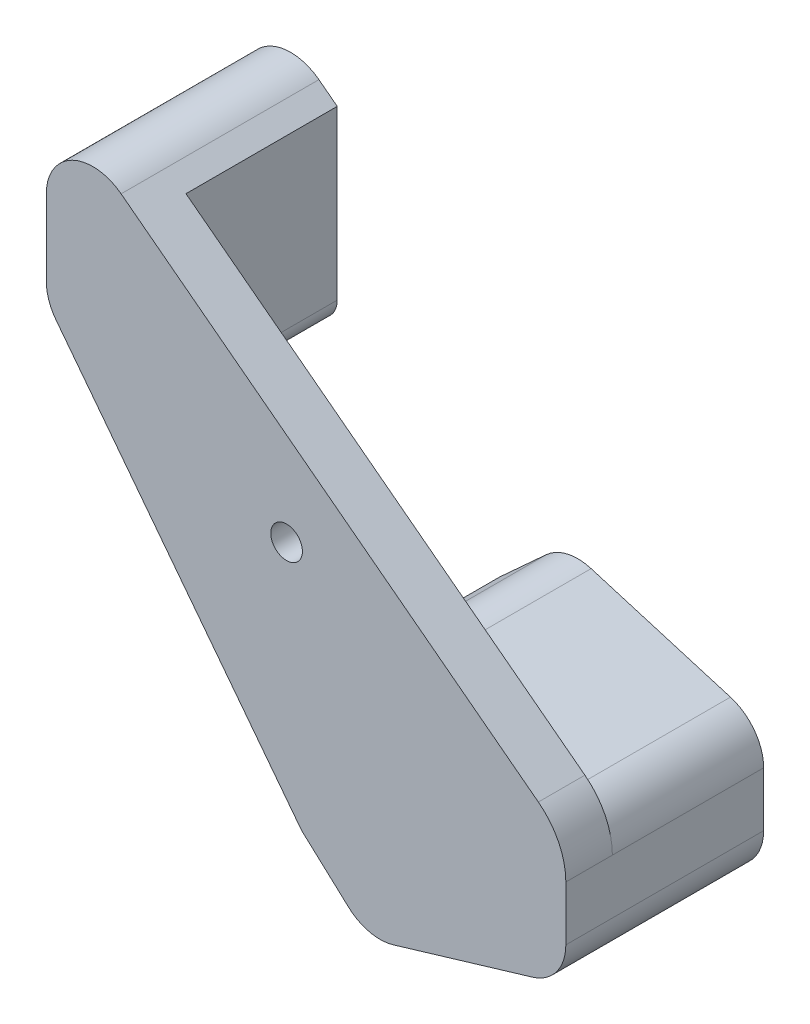
from build123d import *

# Parameters (mm, degrees)
SKETCH1_R           = 2.0319999999999987
SKETCH1_R_2         = 2.0320000000000005
BOSS_EXTRUDE1_DEPTH = 20.6375
FILLET1_R           = 6.35
BOSS_EXTRUDE2_START = 6.35
SKETCH3_R           = 2.159000000000005
BOSS_EXTRUDE2_DEPTH = 6.35
FILLET2_R           = 6.35
BOSS_EXTRUDE3_START = 20.6375
SKETCH4_R           = 2.032
BOSS_EXTRUDE3_DEPTH = 20.6375
FILLET3_R           = 3.175


with BuildPart() as part:
    # Sketch1 → Boss-Extrude1 (new body)
    with BuildSketch(Plane.XY):
        Polygon((0, 12.7), (0, 0), (11.112499999999999, -10.159999999999995), (38.1, -2.094157314500878), (38.1, 14.794157314500877), (11.112499999999999, 22.86), align=None)
        with Locations((11.112499999999999, 0)):
            Circle(SKETCH1_R, mode=Mode.SUBTRACT)
        with Locations((30.1625, 6.35)):
            Circle(SKETCH1_R_2, mode=Mode.SUBTRACT)
        with Locations((11.112499999999999, 12.7)):
            Circle(SKETCH1_R, mode=Mode.SUBTRACT)
    extrude(amount=BOSS_EXTRUDE1_DEPTH)

    # Fillet1
    fillet1_edges = [part.edges().sort_by_distance(p)[0] for p in [
        (0, 12.7, 10.31875),
        (11.112499999999999, 22.86, 10.31875),
        (38.1, 14.794157314500877, 10.31875),
        (38.1, -2.094157314500878, 10.31875),
        (11.112499999999999, -10.159999999999995, 10.31875),
        (0, 0, 10.31875),
    ]]
    fillet(fillet1_edges, radius=FILLET1_R)

    # Sketch3 → Boss-Extrude2 (add)
    with BuildSketch(Plane.XY.offset(20.6375).offset(BOSS_EXTRUDE2_START)):
        with BuildLine():
            Line((2.06521558288966, -1.888197104356259), (-32.77594211232474, 43.413196146372826))
            Line((-32.77594211232474, 43.413196146372826), (-32.77594211232474, 68.81319614637282))
            Line((-32.77594211232474, 68.81319614637282), (34.3497413303207, 17.639286263258136))
            ThreePointArc((34.3497413303207, 17.639286263258136), (37.1111008713377, 14.290641479729842), (38.1, 10.064460353186902))
            Line((38.1, 10.064460353186902), (38.1, 2.635539646813099))
            ThreePointArc((38.1, 2.635539646813099), (36.84259970760916, -1.157602614961311), (33.56836906517824, -3.448540722708889))
            Line((33.56836906517824, -3.448540722708889), (14.560051921917028, -9.129618843824993))
            ThreePointArc((14.560051921917028, -9.129618843824993), (11.324248271129079, -9.235318696210516), (8.456898439628453, -7.732021430517442))
            Line((8.456898439628453, -7.732021430517442), (2.06521558288966, -1.888197104356259))
        make_face()
        with Locations((1.57895919e-09, 31.151886065390322)):
            Circle(SKETCH3_R, mode=Mode.SUBTRACT)
    extrude(amount=-BOSS_EXTRUDE2_DEPTH)

    # Fillet2
    fillet2_edges = [part.edges().sort_by_distance(p)[0] for p in [
        (-32.77594211232474, 68.81319614637282, 23.812499999999996),
        (-32.77594211232474, 43.413196146372826, 23.812499999999996),
    ]]
    fillet(fillet2_edges, radius=FILLET2_R)

    # Sketch4 → Boss-Extrude3 (add)
    with BuildSketch(Plane(origin=(0, 0, 20.6375), x_dir=(-1, 0, 0), z_dir=(0, 0, -1)).offset(BOSS_EXTRUDE3_START)):
        with BuildLine():
            Line((32.77594211232474, 55.98737564555251), (32.77594211232474, 45.5726724047695))
            ThreePointArc((32.77594211232474, 45.5726724047695), (32.437811608681876, 43.52818587784627), (31.459430251294627, 41.701432660856774))
            Line((31.459430251294627, 41.701432660856774), (20.075942112324743, 26.900320790245356))
            Line((20.075942112324743, 26.900320790245356), (20.075942112324743, 59.13122909316789))
            Line((20.075942112324743, 59.13122909316789), (22.576114558777622, 61.03725958559999))
            ThreePointArc((22.576114558777622, 61.03725958559999), (29.243396196686703, 61.678109559777646), (32.77594211232474, 55.98737564555251))
        make_face()
        with Locations(Location((26.42594211232474, 55.98737564555251, 0), (0, 0, 180))):
            Circle(SKETCH4_R, mode=Mode.SUBTRACT)
        with Locations(Location((26.42594211232474, 45.5726724047695, 0), (0, 0, 180))):
            Circle(SKETCH4_R, mode=Mode.SUBTRACT)
    extrude(amount=-BOSS_EXTRUDE3_DEPTH)

    # Fillet3
    fillet3_edges = [part.edges().sort_by_distance(p)[0] for p in [
        (-20.075942112324743, 26.900320790245356, 10.31875),
    ]]
    fillet(fillet3_edges, radius=FILLET3_R)


solid = part.part
